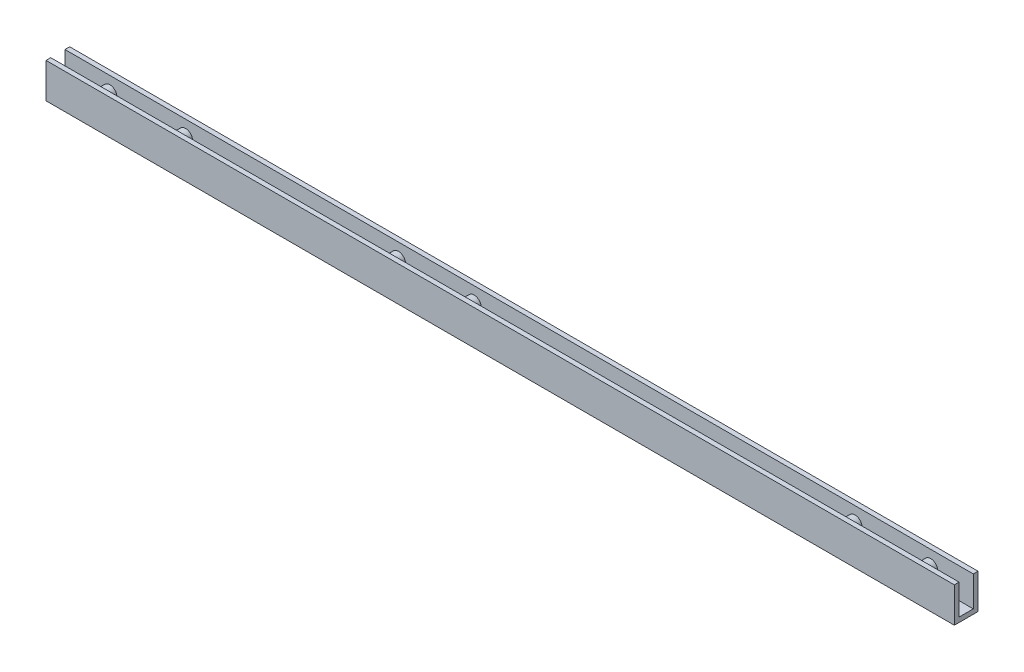
from build123d import *

# Parameters (mm, degrees)
BOSS_EXTRUDE1_DEPTH = 609.6
SKETCH2_R           = 4.7625
BOSS_EXTRUDE5_DEPTH = 9.525


with BuildPart() as part:
    # Sketch1 → Boss-Extrude1 (new body)
    with BuildSketch(Plane(origin=(0, 0, 0), x_dir=(0, 0, -1), z_dir=(1, 0, 0))):
        Polygon((-4.7625, 7.0485), (-4.7625, 11.7475), (-7.9375, 11.7475), (-7.9375, -11.7475), (7.9375, -11.7475), (7.9375, 11.7475), (4.7625, 11.7475), (4.7625, 8.5725), (4.7625, -8.5725), (-4.7625, -8.5725), align=None)
    extrude(amount=BOSS_EXTRUDE1_DEPTH)

    # Sketch2 → Boss-Extrude5 (add)
    with BuildSketch(Plane.XY.offset(4.7625)):
        with Locations((581.025, 1.5875)):
            Circle(SKETCH2_R)
        with Locations((530.225, 1.5875)):
            Circle(SKETCH2_R)
        with Locations((274.6375, 1.5875)):
            Circle(SKETCH2_R)
        with Locations((223.8375, 1.5875)):
            Circle(SKETCH2_R)
        with Locations((30.1625, 1.5875)):
            Circle(SKETCH2_R)
        with Locations((80.9625, 1.5875)):
            Circle(SKETCH2_R)
    extrude(amount=-BOSS_EXTRUDE5_DEPTH)


solid = part.part
